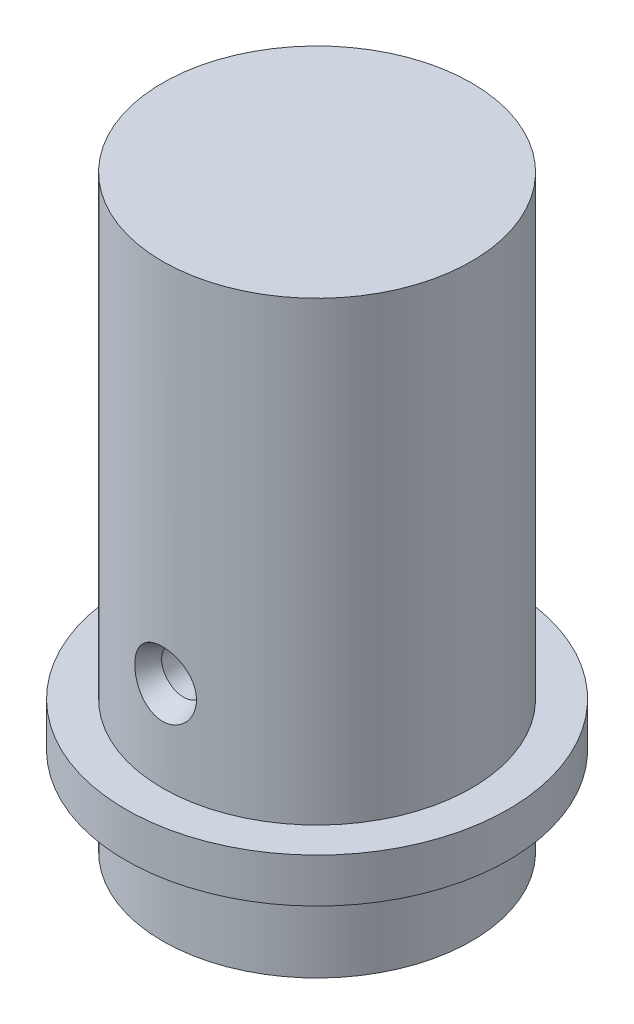
from build123d import *

# Parameters (mm, degrees)
SKETCH1_R          = 10.5
EXTRUDE1_DEPTH     = 40
SKETCH2_R          = 2.5
EXTRUDE2_DEPTH     = 22.5
SKETCH3_R          = 13
SKETCH3_R_2        = 10.5
EXTRUDE3_DEPTH     = 3
SKETCH4_R          = 1.5
CUT_EXTRUDE1_DEPTH = 14
SKETCH7_R          = 2.2
CUT_EXTRUDE2_DEPTH = 1.5
CUT_EXTRUDE2_DRAFT = -26
SKETCH8_R          = 2.2
CUT_EXTRUDE3_DEPTH = 1.5
CUT_EXTRUDE3_TAPER = 26


with BuildPart() as part:
    # Sketch1 → Extrude1 (new body)
    with BuildSketch(Plane(origin=(0, 0, 0), x_dir=(1, 0, 0), z_dir=(0, 1, 0))):
        with Locations(Location((0, 0, 0), (0, 0, 270))):
            Circle(SKETCH1_R)
    extrude(amount=EXTRUDE1_DEPTH)

    # Sketch2 → Extrude2 (cut)
    with BuildSketch(Plane.XZ):
        with Locations(Location((0, 0, 0), (0, 0, 270))):
            Circle(SKETCH2_R)
    extrude(amount=-EXTRUDE2_DEPTH, mode=Mode.SUBTRACT)

    # Sketch3 → Extrude3 (add)
    with BuildSketch(Plane.XZ.offset(-6)):
        with Locations(Location((0, 0, 0), (0, 0, 270))):
            Circle(SKETCH3_R)
        with Locations(Location((0, 0, 0), (0, 0, 270))):
            Circle(SKETCH3_R_2, mode=Mode.SUBTRACT)
    extrude(amount=-EXTRUDE3_DEPTH)

    # Sketch4 → Cut-Extrude1 (cut, symmetric)
    with BuildSketch(Plane.XY):
        with Locations((0, 15.131749204)):
            Circle(SKETCH4_R)
    extrude(amount=CUT_EXTRUDE1_DEPTH, both=True, mode=Mode.SUBTRACT)


with BuildPart() as cut_extrude2_tool:
    # Sketch7 → Cut-Extrude2 (with draft: the straight prism first)
    with BuildSketch(Plane(origin=(0, 24.5, 10.5), x_dir=(-1, 0, 0), z_dir=(0, 0, 1))):
        with Locations((0, 9.368250796)):
            Circle(SKETCH7_R)
    extrude(amount=-CUT_EXTRUDE2_DEPTH)
    # Cut-Extrude2: the draft: its side faces are tilted about the plane it starts from
    cut_extrude2_sides = [cut_extrude2_tool.faces().sort_by_distance(p)[0] for p in [
        (2.2, 15.131749204, 9.75),
    ]]
    draft(cut_extrude2_sides, Plane(origin=(0, 24.5, 10.5), x_dir=(-1, 0, 0), z_dir=(0, 0, 1)), CUT_EXTRUDE2_DRAFT)


with BuildPart() as part_1:
    add(part.part)

    # Cut-Extrude2: cut by cut_extrude2_tool
    add(cut_extrude2_tool.part, mode=Mode.SUBTRACT)

    # Sketch8 → Cut-Extrude3 (cut)
    with BuildSketch(Plane.XY.offset(-10.5)):
        with Locations((0, 15.131749204)):
            Circle(SKETCH8_R)
    extrude(amount=CUT_EXTRUDE3_DEPTH, taper=CUT_EXTRUDE3_TAPER, mode=Mode.SUBTRACT)


solid = part_1.part
